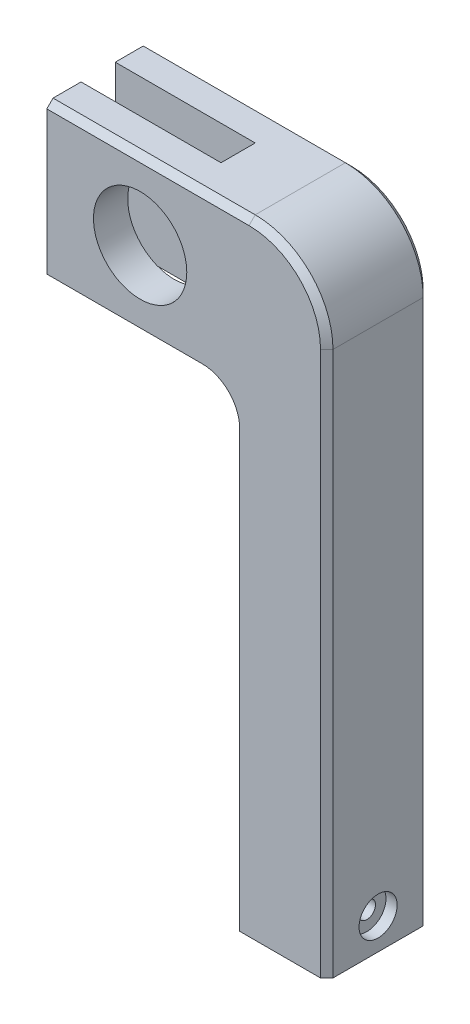
from build123d import *

# Parameters (mm, degrees)
BOSS_EXTRUDE1_DEPTH                     = 16.5
CUT_EXTRUDE1_REACH                      = 221.937
SKETCH3_W                               = 45
SKETCH3_H                               = 11
FILLET1_R                               = 25
FILLET2_R                               = 10
CUT_EXTRUDE2_REACH                      = 223.786
SKETCH4_R                               = 15
CUT_EXTRUDE3_REACH                      = 223.786
SKETCH5_R                               = 9.75
F_3_0MM_DOWEL_HOLE1_D                   = 3
F_3_0MM_DOWEL_HOLE1_DEPTH               = 19.098709071
F_3_0MM_DOWEL_HOLE1_TIP                 = 0.901290929
CHAMFER1_SIZE                           = 2
CBORE_FOR_M5_HEX_HEAD_BOLT1_D           = 5.5
CBORE_FOR_M5_HEX_HEAD_BOLT1_CBORE_D     = 12.24
CBORE_FOR_M5_HEX_HEAD_BOLT1_CBORE_DEPTH = 3.58


with BuildPart() as part:
    # Sketch1 → Boss-Extrude1 (new, symmetric)
    with BuildSketch(Plane.XY):
        Polygon((0, 0), (-30, 0), (-30, 150), (-90, 150), (-90, 200), (0, 200), align=None)
    extrude(amount=BOSS_EXTRUDE1_DEPTH, both=True)

    # Sketch3 → Cut-Extrude1 (cut, up to next)
    with BuildSketch(Plane(origin=(0, 200, 0), x_dir=(1, 0, 0), z_dir=(0, 1, 0)), mode=Mode.PRIVATE) as cut_extrude1_sk1:
        with Locations((-67.5, 0)):
            Rectangle(SKETCH3_W, SKETCH3_H)
    cut_extrude1_tool1 = extrude(cut_extrude1_sk1.sketch, amount=-CUT_EXTRUDE1_REACH, mode=Mode.PRIVATE) & part.part
    add(cut_extrude1_tool1.solids().sort_by_distance((-67.5, 200, 0))[0], mode=Mode.SUBTRACT)

    # Fillet1
    fillet1_edges = [part.edges().sort_by_distance(p)[0] for p in [
        (0, 200, 0),
    ]]
    fillet(fillet1_edges, radius=FILLET1_R)

    # Fillet2
    fillet2_edges = [part.edges().sort_by_distance(p)[0] for p in [
        (-30, 150, 0),
    ]]
    fillet(fillet2_edges, radius=FILLET2_R)

    # Sketch4 → Cut-Extrude2 (cut, up to next)
    with BuildSketch(Plane.XY.offset(16.5), mode=Mode.PRIVATE) as cut_extrude2_sk1:
        with Locations((-60, 175)):
            Circle(SKETCH4_R)
    cut_extrude2_tool1 = extrude(cut_extrude2_sk1.sketch, amount=-CUT_EXTRUDE2_REACH, mode=Mode.PRIVATE) & part.part
    add(cut_extrude2_tool1.solids().sort_by_distance((-60, 175, 16.5))[0], mode=Mode.SUBTRACT)

    # Sketch5 → Cut-Extrude3 (cut, up to next)
    with BuildSketch(Plane(origin=(0, 0, -16.5), x_dir=(-1, 0, 0), z_dir=(0, 0, -1)), mode=Mode.PRIVATE) as cut_extrude3_sk1:
        with Locations((60, 175)):
            Circle(SKETCH5_R)
    cut_extrude3_tool1 = extrude(cut_extrude3_sk1.sketch, amount=-CUT_EXTRUDE3_REACH, mode=Mode.PRIVATE) & part.part
    add(cut_extrude3_tool1.solids().sort_by_distance((-60, 175, -16.5))[0], mode=Mode.SUBTRACT)

    # Ø3.0mm Dowel Hole1
    with Locations(Plane(origin=(-90, 195, -11), x_dir=(0, 0, -1), z_dir=(-1, 0, 0))):
        with Locations((0, 0), (0, 40), (-22, 0), (-22, 40)):
            Hole(F_3_0MM_DOWEL_HOLE1_D / 2, depth=F_3_0MM_DOWEL_HOLE1_DEPTH)
            with Locations((0, 0, -(F_3_0MM_DOWEL_HOLE1_DEPTH + F_3_0MM_DOWEL_HOLE1_TIP / 2))):  # 118° drill point
                Cone(0, F_3_0MM_DOWEL_HOLE1_D / 2, F_3_0MM_DOWEL_HOLE1_TIP, mode=Mode.SUBTRACT)

    # Chamfer1
    chamfer1_edges = [part.edges().sort_by_distance(p)[0] for p in [
        (-65, 150, -16.5),
        (-57.5, 200, 16.5),
        (-7.32233047, 192.67766953, 16.5),
        (-57.5, 200, -16.5),
        (-7.32233047, 192.67766953, -16.5),
        (-30, 70, 16.5),
        (-30, 70, -16.5),
        (-32.928932188, 147.071067812, 16.5),
        (-32.928932188, 147.071067812, -16.5),
        (0, 87.5, -16.5),
        (-65, 150, 16.5),
        (0, 87.5, 16.5),
    ]]
    chamfer(chamfer1_edges, length=CHAMFER1_SIZE)

    # CBORE for M5 Hex Head Bolt1 (through all)
    with Locations(Plane(origin=(0, 0, 0), x_dir=(0, 0, -1), z_dir=(1, 0, 0))):
        with Locations((0, 10)):
            CounterBoreHole(CBORE_FOR_M5_HEX_HEAD_BOLT1_D / 2, CBORE_FOR_M5_HEX_HEAD_BOLT1_CBORE_D / 2, CBORE_FOR_M5_HEX_HEAD_BOLT1_CBORE_DEPTH)


solid = part.part
